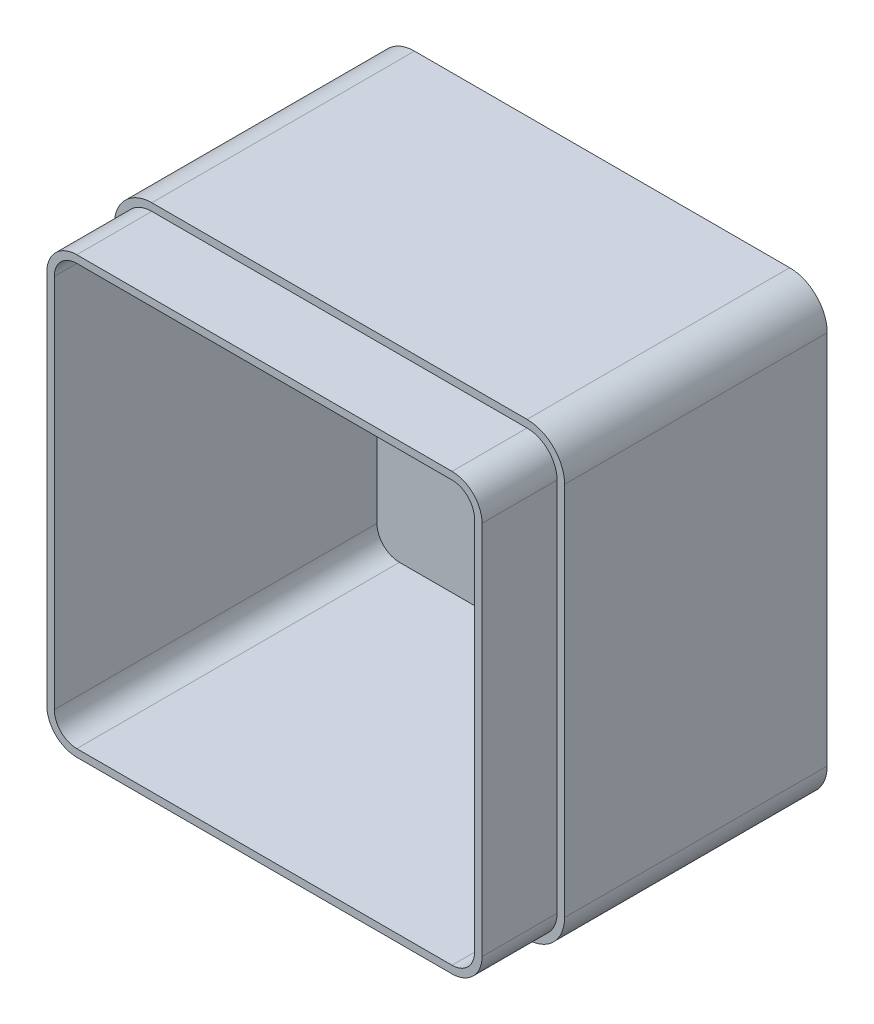
from build123d import *

# Parameters (mm, degrees)
SKETCH1_W           = 120
SKETCH1_H           = 120
BOSS_EXTRUDE1_DEPTH = 90
FILLET1_R           = 10
SHELL2_T            = -4
CUT_EXTRUDE13_DEPTH = 20


with BuildPart() as part:
    # Sketch1 → Boss-Extrude1 (new body)
    with BuildSketch(Plane.XY):
        with Locations((60, 60)):
            Rectangle(SKETCH1_W, SKETCH1_H)
    extrude(amount=BOSS_EXTRUDE1_DEPTH)

    # Fillet1
    fillet1_edges = [part.edges().sort_by_distance(p)[0] for p in [
        (0, 120, 45),
        (120, 120, 45),
        (120, 0, 45),
        (0, 0, 45),
    ]]
    fillet(fillet1_edges, radius=FILLET1_R)

    # Shell2
    shell2_openings = [part.faces().sort_by_distance(p)[0] for p in [
        (60, 60, 90),
    ]]
    offset(amount=SHELL2_T, openings=shell2_openings, kind=Kind.INTERSECTION)

    # Sketch4 → Cut-Extrude13 (cut)
    with BuildSketch(Plane.XY.offset(90)):
        with BuildLine():
            Line((0, 110), (0, 10))
            ThreePointArc((0, 10), (2.928932188, 2.928932188), (10, 0))
            Line((10, 0), (110, 0))
            ThreePointArc((110, 0), (117.071067812, 2.928932188), (120, 10))
            Line((120, 10), (120, 110))
            ThreePointArc((120, 110), (117.071067812, 117.071067812), (110, 120))
            Line((110, 120), (10, 120))
            ThreePointArc((10, 120), (2.928932188, 117.071067812), (0, 110))
        make_face()
        with BuildLine():
            Line((2, 110), (2, 10))
            ThreePointArc((2, 10), (4.343145751, 4.343145751), (10, 2))
            Line((10, 2), (110, 2))
            ThreePointArc((110, 2), (115.656854249, 4.343145751), (118, 10))
            Line((118, 10), (118, 110))
            ThreePointArc((118, 110), (115.656854249, 115.656854249), (110, 118))
            Line((110, 118), (10, 118))
            ThreePointArc((10, 118), (4.343145751, 115.656854249), (2, 110))
        make_face(mode=Mode.SUBTRACT)
    extrude(amount=-CUT_EXTRUDE13_DEPTH, mode=Mode.SUBTRACT)


solid = part.part
